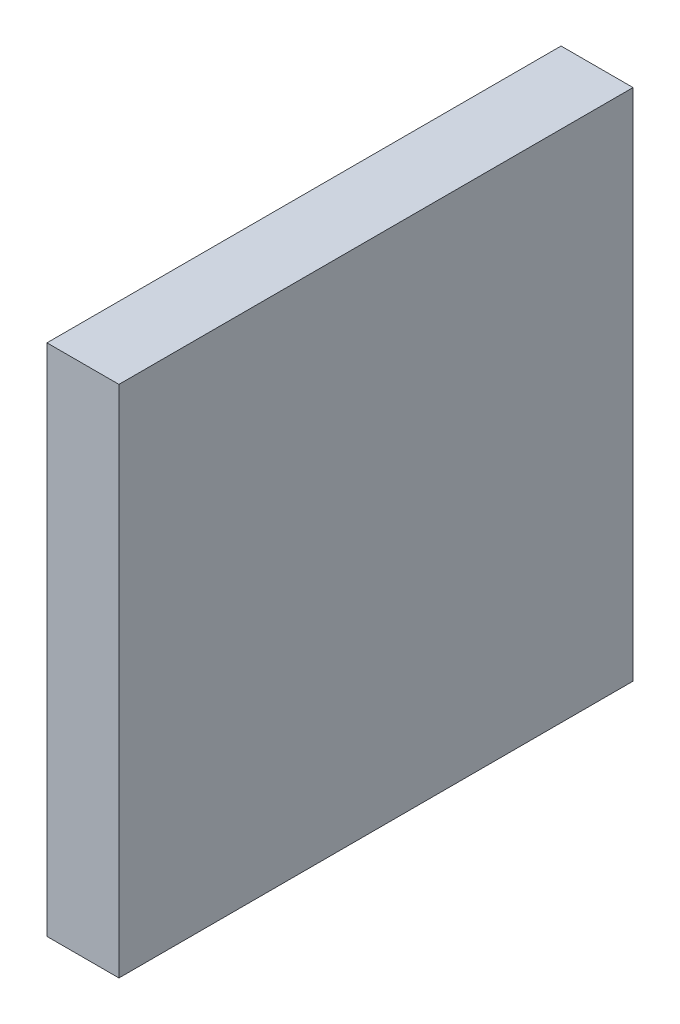
from build123d import *

# Parameters (mm, degrees)
SK_BOX_0_W  = 14
SK_BOX_0_H  = 100
BOX_0_DEPTH = 100


with BuildPart() as part:
    # SK_Box_0 → Box_0 (new body)
    with BuildSketch(Plane.XY.offset(100)):
        with Locations((39, 0)):
            Rectangle(SK_BOX_0_W, SK_BOX_0_H)
    extrude(amount=BOX_0_DEPTH)


solid = part.part
